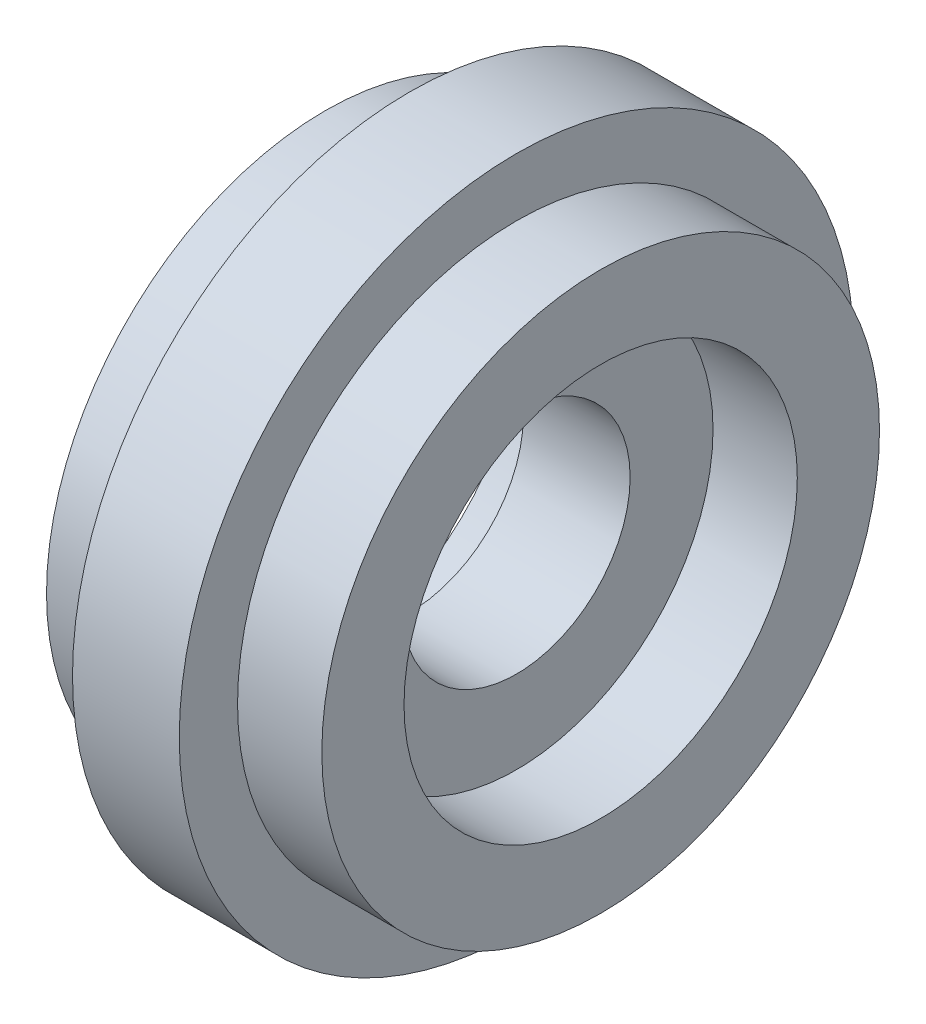
from build123d import *

# Parameters (mm, degrees)
F_8_1_8_1_DURCHMESSER_BOHRUNG1_D = 8.1


with BuildPart() as part:
    # Skizze1 → Rotation1 (revolve)
    with BuildSketch(Plane.XY, mode=Mode.PRIVATE) as rotation1_sk:
        Polygon((0, 0), (0, 12), (1.9, 12), (1.9, 9.925), (4.9, 9.925), (4.9, 7), (1.9, 7), (1.9, 0), align=None)
    rotation1 = revolve(rotation1_sk.sketch.rotate(Axis((0, 0, 0), (-1, 0, 0)), 90), axis=Axis((0, 0, 0), (-1, 0, 0)))

    # Ø8.1 (8.1) Durchmesser Bohrung1 (through all)
    with Locations(Plane.ZY):
        with Locations((0, 0)):
            f_8_1_8_1_durchmesser_bohrung1 = Hole(F_8_1_8_1_DURCHMESSER_BOHRUNG1_D / 2)

    # Spiegeln1: Rotation1, Ø8.1 (8.1) Durchmesser Bohrung1 across plane
    add(rotation1.mirror(Plane(origin=(0, 0, 0), x_dir=(0, 0, 1), z_dir=(1, 0, 0))))
    add(f_8_1_8_1_durchmesser_bohrung1.mirror(Plane(origin=(0, 0, 0), x_dir=(0, 0, 1), z_dir=(1, 0, 0))), mode=Mode.SUBTRACT)


solid = part.part
